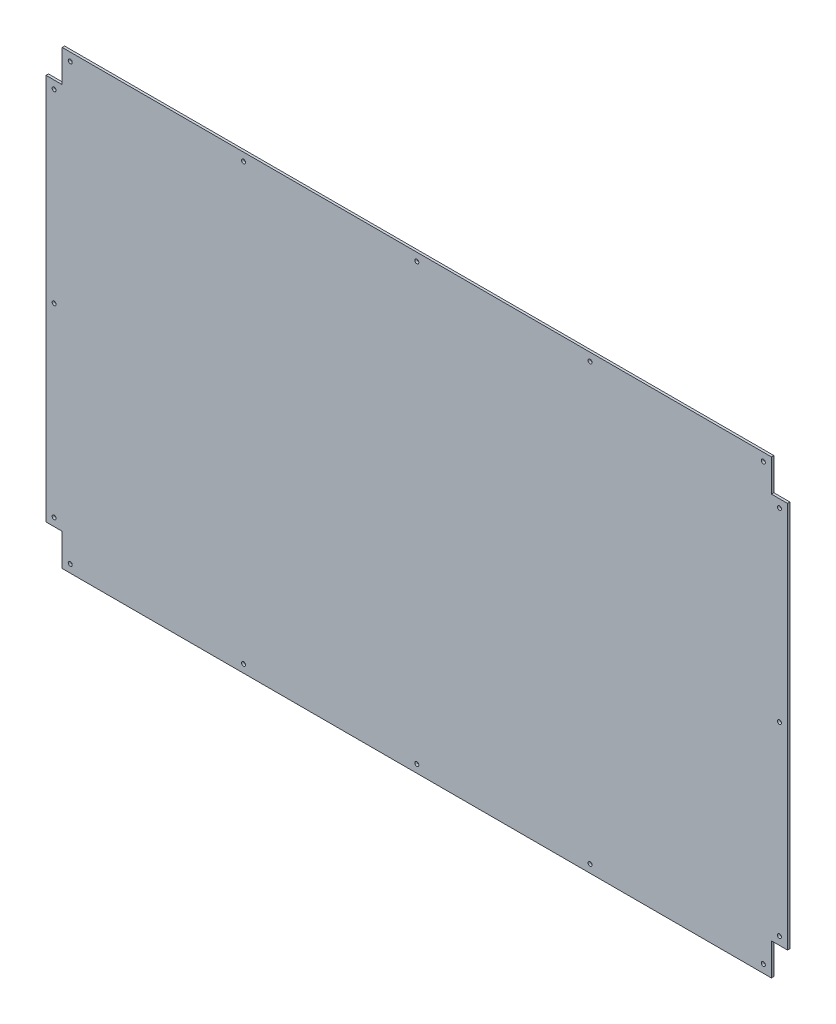
from build123d import *

# Parameters (mm, degrees)
BOSS_EXTRUDE1_DEPTH = 3
SKETCH2_R           = 2.5
CUT_EXTRUDE1_DEPTH  = 613.75171356


with BuildPart() as part:
    # Sketch1 → Boss-Extrude1 (new body)
    with BuildSketch(Plane.XY):
        Polygon((-389.697293258, 339.185509658), (490.302706742, 339.185509658), (490.302706742, 299.185509658), (510.302706742, 299.185509658), (510.302706742, -180.814490342), (490.302706742, -180.814490342), (490.302706742, -220.814490342), (-389.697293258, -220.814490342), (-389.697293258, -180.814490342), (-409.697293258, -180.814490342), (-409.697293258, 299.185509658), (-389.697293258, 299.185509658), align=None)
    extrude(amount=BOSS_EXTRUDE1_DEPTH)

    # Sketch2 → Cut-Extrude1 (cut, through all)
    with BuildSketch(Plane.XY.offset(3)):
        with Locations((-379.697293258, 329.185509658)):
            Circle(SKETCH2_R)
        with Locations((480.302706742, 329.185509658)):
            Circle(SKETCH2_R)
        with Locations((-164.697293258, 329.185509658)):
            Circle(SKETCH2_R)
        with Locations((50.302706742, 329.185509658)):
            Circle(SKETCH2_R)
        with Locations((265.302706742, 329.185509658)):
            Circle(SKETCH2_R)
        with Locations((-379.697293258, -210.814490342)):
            Circle(SKETCH2_R)
        with Locations((480.302706742, -210.814490342)):
            Circle(SKETCH2_R)
        with Locations((265.302706742, -210.814490342)):
            Circle(SKETCH2_R)
        with Locations((50.302706742, -210.814490342)):
            Circle(SKETCH2_R)
        with Locations((-164.697293258, -210.814490342)):
            Circle(SKETCH2_R)
        with Locations((-399.697293258, 289.185509658)):
            Circle(SKETCH2_R)
        with Locations((-399.697293258, -170.814490342)):
            Circle(SKETCH2_R)
        with Locations((-399.697293258, 59.185509658)):
            Circle(SKETCH2_R)
        with Locations((500.302706742, 289.185509658)):
            Circle(SKETCH2_R)
        with Locations((500.302706742, 59.185509658)):
            Circle(SKETCH2_R)
        with Locations((500.302706742, -170.814490342)):
            Circle(SKETCH2_R)
    extrude(amount=-CUT_EXTRUDE1_DEPTH, mode=Mode.SUBTRACT)


solid = part.part
